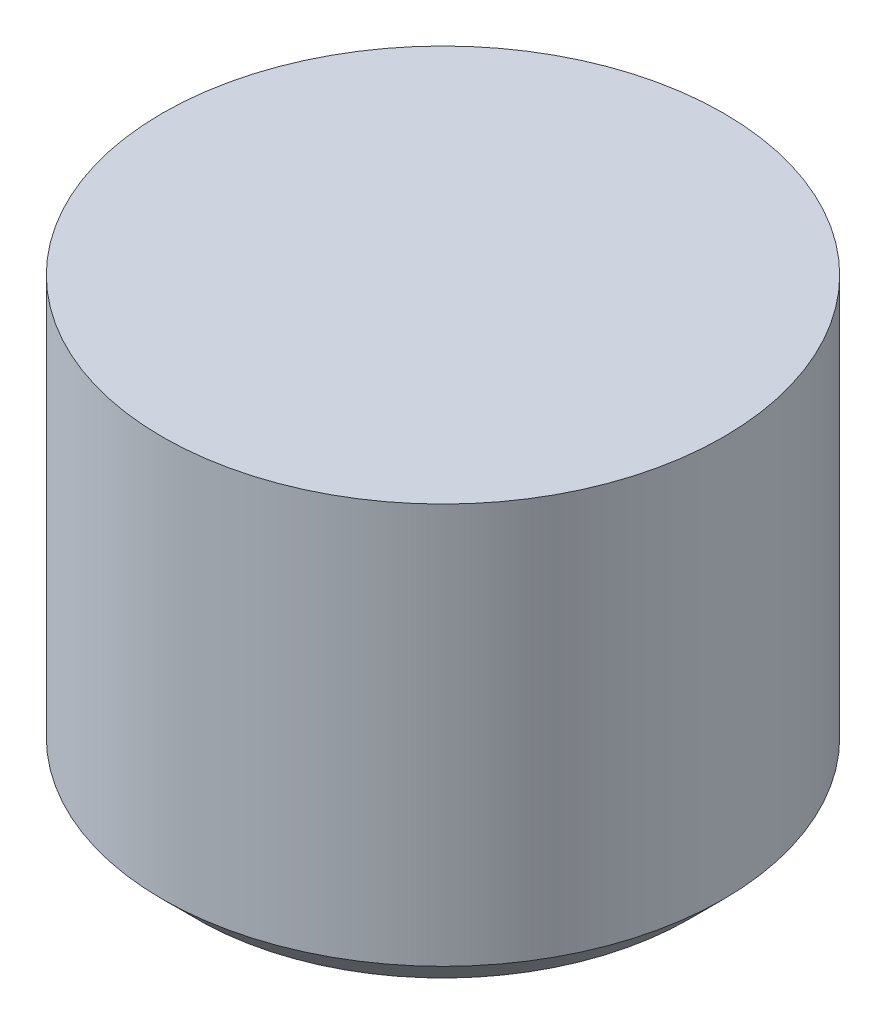
from build123d import *


with BuildPart() as part:
    # Szkic1 → Obrót1 (revolve)
    with BuildSketch(Plane.XY):
        Polygon((0, 17.416812705), (-24.425, 17.416812705), (-24.425, -17.443187295), (-21.425, -20.443187295), (0, -20.443187295), align=None)
    revolve(axis=Axis((0, 17.416812705, 0), (0, -1, 0)))


solid = part.part
